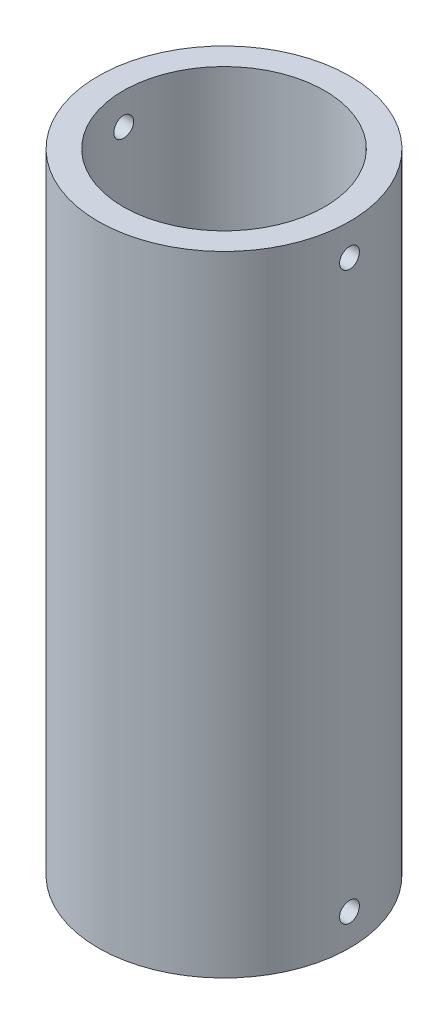
from build123d import *

# Parameters (mm, degrees)
SKETCH1_R               = 20
SKETCH1_R_2             = 16
BOSS_EXTRUDE1_DEPTH     = 100
CUT_EXTRUDE1_DEPTH      = 52
CUT_EXTRUDE1_DEPTH_BACK = 46
SKETCH2_R               = 1.575


with BuildPart() as part:
    # Sketch1 → Boss-Extrude1 (new body)
    with BuildSketch(Plane(origin=(0, 0, 0), x_dir=(1, 0, 0), z_dir=(0, 1, 0))):
        with Locations(Location((0, 0, 0), (0, 0, 270))):
            Circle(SKETCH1_R)
        with Locations(Location((0, 0, 0), (0, 0, 270))):
            Circle(SKETCH1_R_2, mode=Mode.SUBTRACT)
    extrude(amount=BOSS_EXTRUDE1_DEPTH)

    # Sketch2 → Cut-Extrude1 (cut, two sides: drawn at the far end of the back side and taken through both)
    with BuildSketch(Plane(origin=(0, 0, 0), x_dir=(0, 0, -1), z_dir=(1, 0, 0)).offset(-CUT_EXTRUDE1_DEPTH_BACK)):
        with Locations(Location((0, 95, 0), (0, 0, 180))):
            Circle(SKETCH2_R)
        with Locations(Location((0, 5, 0), (0, 0, 180))):
            Circle(SKETCH2_R)
    extrude(amount=CUT_EXTRUDE1_DEPTH + CUT_EXTRUDE1_DEPTH_BACK, mode=Mode.SUBTRACT)


solid = part.part
